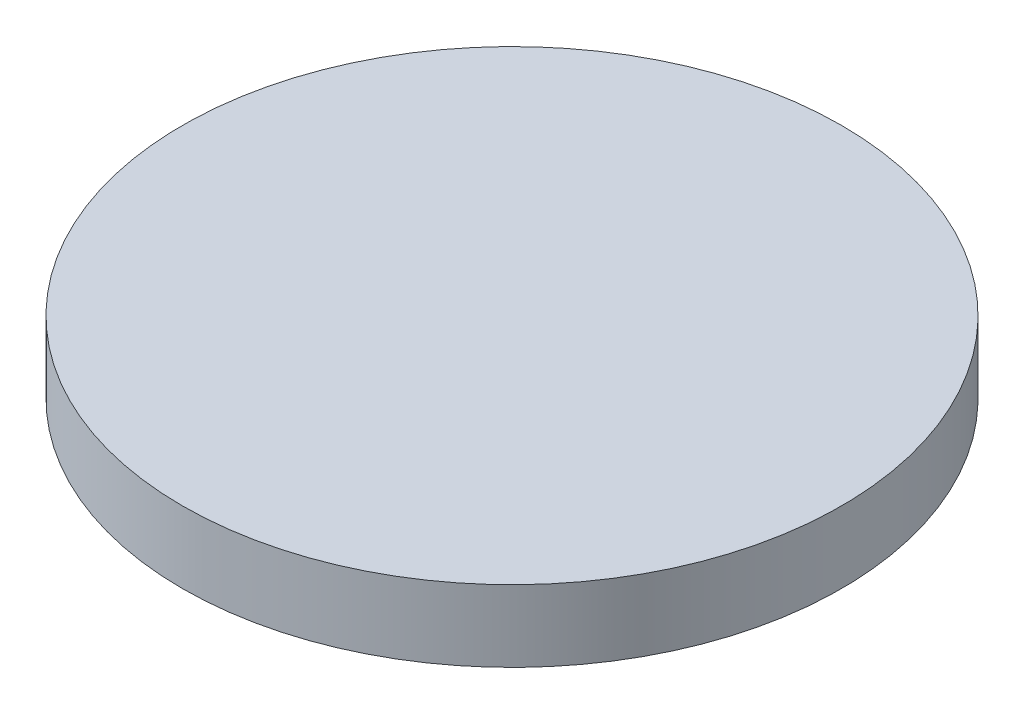
from build123d import *

# Parameters (mm, degrees)
ESBO_O1_R                = 23
RESSALTO_EXTRUS_O1_DEPTH = 5


with BuildPart() as part:
    # Esboço1 → Ressalto-extrusão1 (new body)
    with BuildSketch(Plane(origin=(0, 0, 0), x_dir=(1, 0, 0), z_dir=(0, 1, 0))):
        with Locations(Location((0, 0, 0), (0, 0, 270))):
            Circle(ESBO_O1_R)
    extrude(amount=RESSALTO_EXTRUS_O1_DEPTH)


solid = part.part
